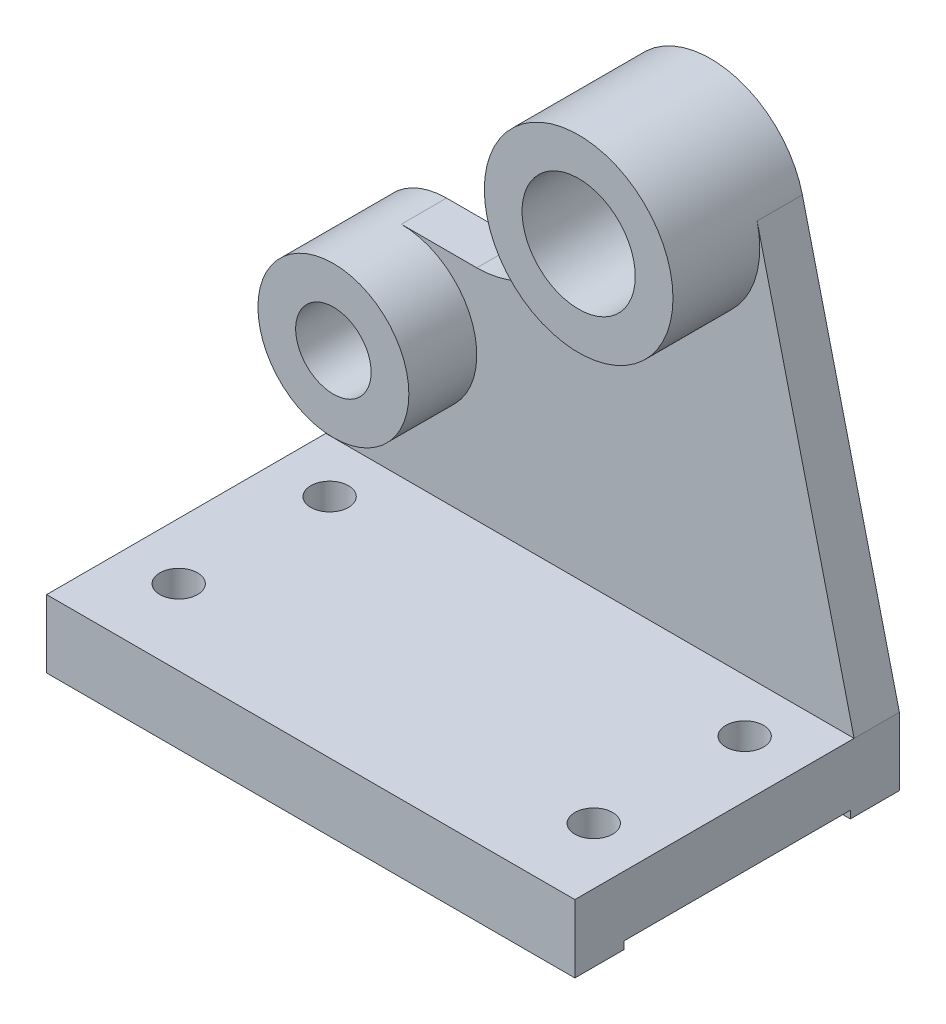
from build123d import *

# Parameters (mm, degrees)
SKETCH2_W           = 140
SKETCH2_H           = 18
BOSS_EXTRUDE1_DEPTH = 86
BOSS_EXTRUDE2_DEPTH = 12
SKETCH2_4_R         = 15
BOSS_EXTRUDE3_DEPTH = 35
SKETCH2_5_R         = 10
BOSS_EXTRUDE4_DEPTH = 30
SKETCH3_W           = 60
SKETCH3_H           = 4
CUT_EXTRUDE1_DEPTH  = 140
SKETCH4_R           = 5
CUT_EXTRUDE2_DEPTH  = 140


with BuildPart() as part:
    # Sketch2 → Boss-Extrude1 (new body)
    with BuildSketch(Plane.XY):
        Rectangle(SKETCH2_W, SKETCH2_H)
    extrude(amount=BOSS_EXTRUDE1_DEPTH)

    # Sketch2<3> → Boss-Extrude2 (add)
    with BuildSketch(Plane.XY):
        with BuildLine():
            Line((-70, 47), (-70, 9))
            Line((-70, 9), (70, 9))
            Line((70, 9), (44.294494718, 114.897247359))
            ThreePointArc((44.294494718, 114.897247359), (44.822997079, 111.969649142), (45, 109))
            ThreePointArc((45, 109), (20, 84), (-5, 109))
            Line((-5, 109), (-5, 92))
            ThreePointArc((-5, 92), (-12.32233047, 74.32233047), (-30, 67))
            Line((-30, 67), (-50, 67))
            ThreePointArc((-50, 67), (-35.857864376, 61.142135624), (-30, 47))
            ThreePointArc((-30, 47), (-50, 27), (-70, 47))
        make_face()
    extrude(amount=BOSS_EXTRUDE2_DEPTH)

    # Sketch2<4> → Boss-Extrude3 (add)
    with BuildSketch(Plane.XY):
        with BuildLine():
            ThreePointArc((45, 109), (44.822997079, 111.969649142), (44.294494718, 114.897247359))
            ThreePointArc((44.294494718, 114.897247359), (17.030350858, 133.822997079), (-5, 109))
            ThreePointArc((-5, 109), (20, 84), (45, 109))
        make_face()
        with Locations((20, 109)):
            Circle(SKETCH2_4_R, mode=Mode.SUBTRACT)
    extrude(amount=BOSS_EXTRUDE3_DEPTH)

    # Sketch2<5> → Boss-Extrude4 (add)
    with BuildSketch(Plane.XY):
        with BuildLine():
            ThreePointArc((-50, 67), (-64.142135624, 61.142135624), (-70, 47))
            ThreePointArc((-70, 47), (-50, 27), (-30, 47))
            ThreePointArc((-30, 47), (-35.857864376, 61.142135624), (-50, 67))
        make_face()
        with Locations((-50, 47)):
            Circle(SKETCH2_5_R, mode=Mode.SUBTRACT)
    extrude(amount=BOSS_EXTRUDE4_DEPTH)

    # Sketch3 → Cut-Extrude1 (cut)
    with BuildSketch(Plane(origin=(70, 0, 0), x_dir=(0, 0, -1), z_dir=(1, 0, 0))):
        with Locations((-43, -9)):
            Rectangle(SKETCH3_W, SKETCH3_H)
    extrude(amount=-CUT_EXTRUDE1_DEPTH, mode=Mode.SUBTRACT)

    # Sketch4 → Cut-Extrude2 (cut)
    with BuildSketch(Plane(origin=(0, 9, 0), x_dir=(1, 0, 0), z_dir=(0, 1, 0))):
        with Locations((-55, -66)):
            Circle(SKETCH4_R)
        with Locations((55, -66)):
            Circle(SKETCH4_R)
        with Locations((55, -26)):
            Circle(SKETCH4_R)
        with Locations((-55, -26)):
            Circle(SKETCH4_R)
    extrude(amount=-CUT_EXTRUDE2_DEPTH, mode=Mode.SUBTRACT)


solid = part.part
